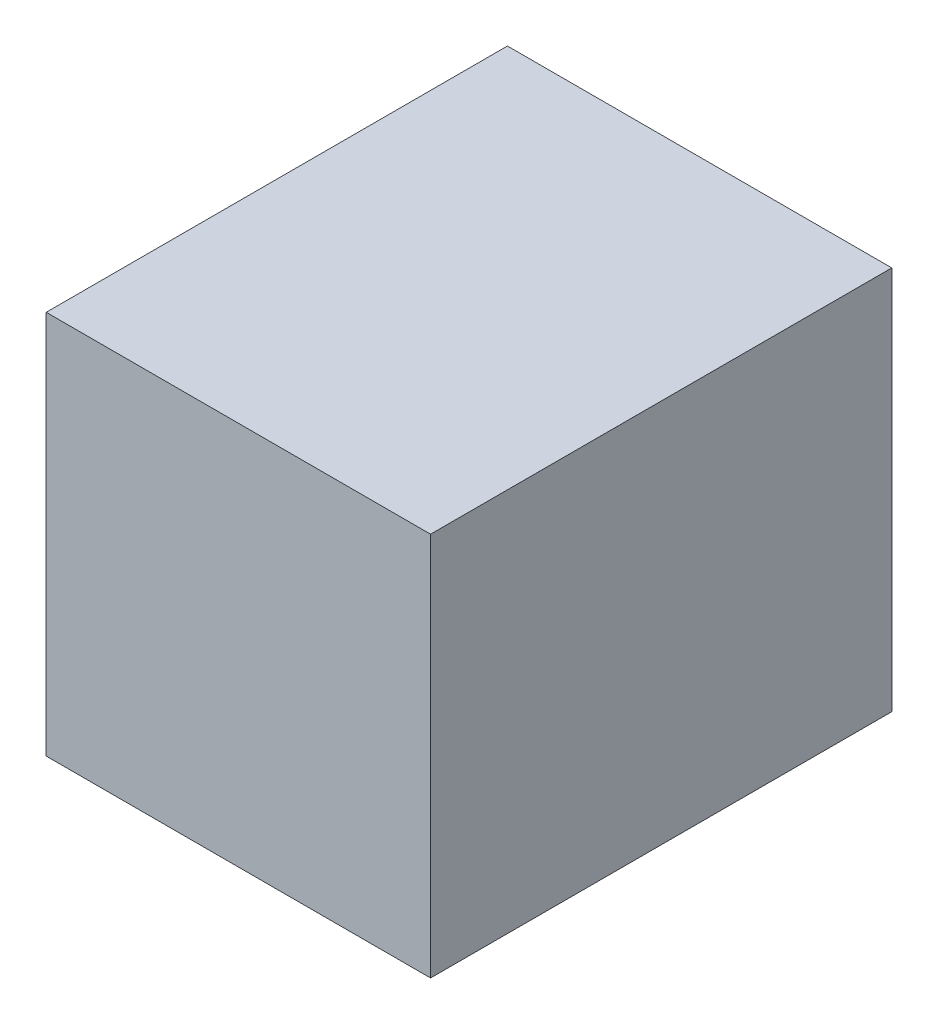
from build123d import *

# Parameters (mm, degrees)
SKETCH1_W           = 508
SKETCH1_H           = 609.6
BOSS_EXTRUDE1_DEPTH = 508


with BuildPart() as part:
    # Sketch1 → Boss-Extrude1 (new body)
    with BuildSketch(Plane(origin=(0, 0, 0), x_dir=(1, 0, 0), z_dir=(0, 1, 0))):
        Rectangle(SKETCH1_W, SKETCH1_H)
    extrude(amount=BOSS_EXTRUDE1_DEPTH)


solid = part.part
